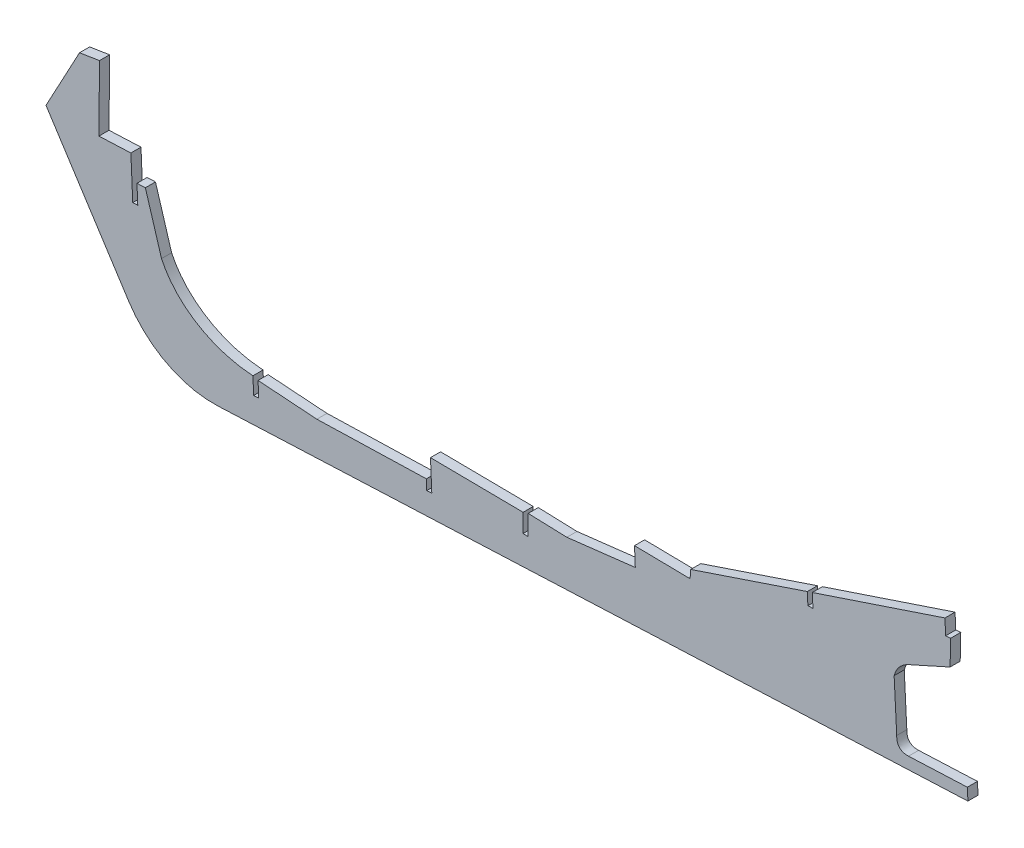
from build123d import *

# Parameters (mm, degrees)
BOSS_EXTRU_3_DEPTH = 6
CONG_1_R           = 60


with BuildPart() as part:
    # Esquisse3 → Boss.-Extru.3 (new body)
    with BuildSketch(Plane(origin=(-3.638307048, 7.762911288, 0), x_dir=(0.984807753012208, -0.1736481776669307, 0), z_dir=(0, 0, 1))):
        with BuildLine():
            Line((-71.559692406, 137.419515489), (-65.127612513, 98.953577983))
            Line((-65.127612513, 98.953577983), (-46.578471081, 103.06810738))
            Line((-46.578471081, 103.06810738), (-41.164616612, 78.661342338))
            Line((-41.164616612, 78.661342338), (-38.235804807, 79.311004874))
            Line((-38.235804807, 79.311004874), (-40.632352311, 90.115131983))
            Line((-40.632352311, 90.115131983), (-35.750999303, 91.197902877))
            Line((-35.750999303, 91.197902877), (-20.829774243, 61.686423244))
            add(Edge.make_bspline(
                [(38.37456384, 38.513359507), (16.587805448, 35.939302498), (-7.762740615, 43.297007319), (-20.829774243, 61.686423244)],
                knots=[0, 0, 0, 0, 1, 1, 1, 1], degree=3))
            Line((38.37456384, 38.513359507), (40.525402219, 28.816939468))
            Line((40.525402219, 28.816939468), (43.463887608, 29.421342988))
            Line((43.463887608, 29.421342988), (41.519581302, 38.186674133))
            Line((41.519581302, 38.186674133), (76.331388066, 41.811327195))
            Line((76.331388066, 41.811327195), (139.998021134, 54.909412313))
            Line((139.998021134, 54.909412313), (141.283555233, 49.113961235))
            Line((141.283555233, 49.113961235), (144.212367038, 49.763623772))
            Line((144.212367038, 49.763623772), (140.328182794, 67.274322069))
            Line((140.328182794, 67.274322069), (194.592792235, 76.238258828))
            Line((194.592792235, 76.238258828), (196.409589011, 65.389330334))
            Line((196.409589011, 65.389330334), (199.368387691, 65.884820364))
            Line((199.368387691, 65.884820364), (197.394020749, 77.674672735))
            Line((197.394020749, 77.674672735), (220.126485179, 80.877779775))
            Line((220.126485179, 80.877779775), (259.319797933, 92.644471957))
            Line((259.319797933, 92.644471957), (256.937701966, 103.383448575))
            Line((256.937701966, 103.383448575), (289.522543291, 108.601505288))
            Line((289.522543291, 108.601505288), (289.047470566, 113.57888471))
            Line((289.047470566, 113.57888471), (353.181348825, 148.485449649))
            Line((353.181348825, 148.485449649), (354.726860043, 141.517968462))
            Line((354.726860043, 141.517968462), (357.655671848, 142.167630999))
            Line((357.655671848, 142.167630999), (355.923238418, 149.977795812))
            Line((355.923238418, 149.977795812), (428.895770917, 189.525355795))
            Line((428.895770917, 189.525355795), (430.844758526, 180.73892038))
            Line((430.844758526, 180.73892038), (433.739949932, 181.524965365))
            Line((433.739949932, 181.524965365), (436.014097486, 166.698359115))
            Line((436.014097486, 166.698359115), (415.342101107, 152.638893772))
            add(Edge.make_bspline(
                [(415.342101107, 152.638893772), (407.545289081, 148.009298465), (406.957115975, 140.201368924)],
                knots=[0, 0, 0, 1, 1, 1], degree=2))
            Line((406.957115975, 140.201368924), (413.667773401, 110.961548868))
            add(Edge.make_bspline(
                [(413.667773401, 110.961548868), (414.76605418, 103.736931255), (421.786696865, 105.123477115)],
                knots=[0, 0, 0, 1, 1, 1], degree=2))
            Line((421.786696865, 105.123477115), (455.956167923, 112.702873372))
            Line((455.956167923, 112.702873372), (457.472047174, 105.86897916))
            Line((457.472047174, 105.86897916), (159.709513668, 39.819954639))
            Line((159.709513668, 39.819954639), (-11.137841622, 1.922973356))
            Line((-11.137841622, 1.922973356), (-96.082570909, 93.62571577))
            Line((-96.082570909, 93.62571577), (-82.90301036, 133.504271207))
            Line((-82.90301036, 133.504271207), (-71.559692406, 137.419515489))
        make_face()
    extrude(amount=BOSS_EXTRU_3_DEPTH)

    # Congé1
    cong_1_edges = [part.edges().sort_by_distance(p)[0] for p in [
        (-14.27301901, 11.590736258, 3),
    ]]
    fillet(cong_1_edges, radius=CONG_1_R)


solid = part.part
